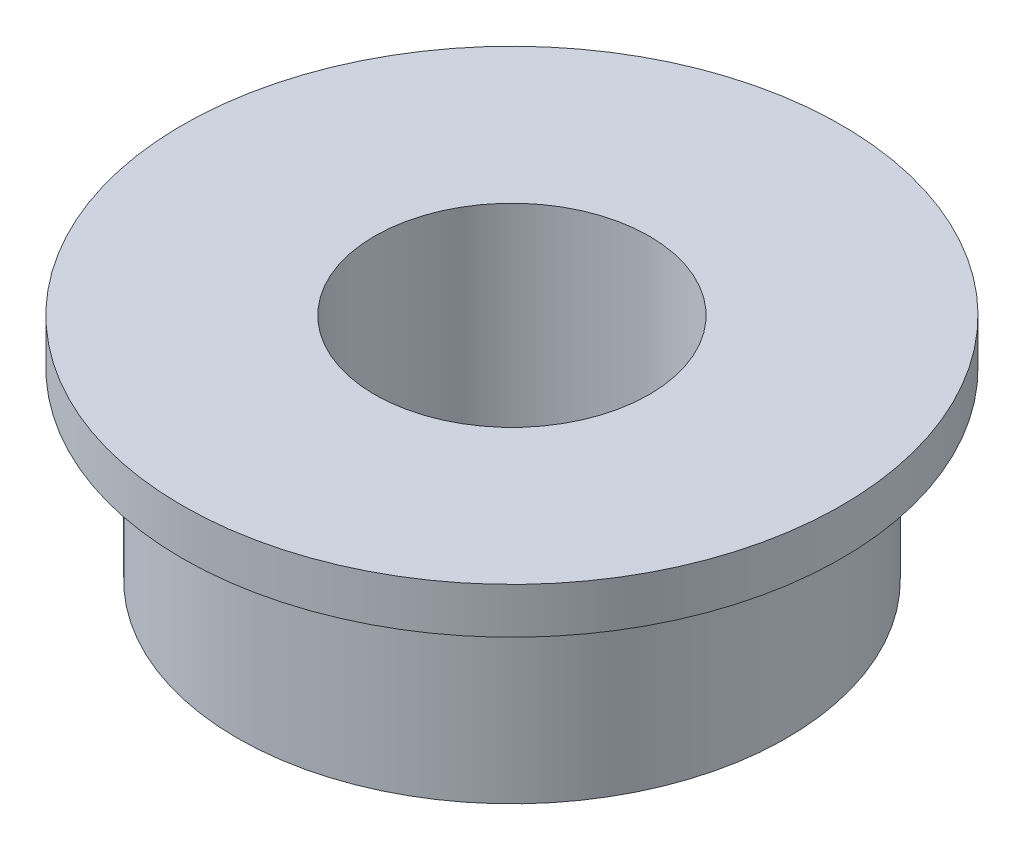
from build123d import *

# Parameters (mm, degrees)
SKETCH_1_R      = 3
SKETCH_1_R_2    = 1.5
EXTRUDE_1_DEPTH = 2
SKETCH_2_R      = 3.6
SKETCH_2_R_2    = 1.5
EXTRUDE_2_DEPTH = 0.5


with BuildPart() as part:
    # 草图1 → 凸台-拉伸1 (new body)
    with BuildSketch(Plane(origin=(0, 0, 0), x_dir=(1, 0, 0), z_dir=(0, 1, 0))):
        with Locations(Location((0, 0, 0), (0, 0, 270))):
            Circle(SKETCH_1_R)
        with Locations(Location((0, 0, 0), (0, 0, 270))):
            Circle(SKETCH_1_R_2, mode=Mode.SUBTRACT)
    extrude(amount=EXTRUDE_1_DEPTH)

    # 草图2 → 凸台-拉伸2 (add)
    with BuildSketch(Plane(origin=(0, 2, 0), x_dir=(1, 0, 0), z_dir=(0, 1, 0))):
        with Locations(Location((0, 0, 0), (0, 0, 270))):
            Circle(SKETCH_2_R)
        with Locations(Location((0, 0, 0), (0, 0, 270))):
            Circle(SKETCH_2_R_2, mode=Mode.SUBTRACT)
    extrude(amount=EXTRUDE_2_DEPTH)


solid = part.part
